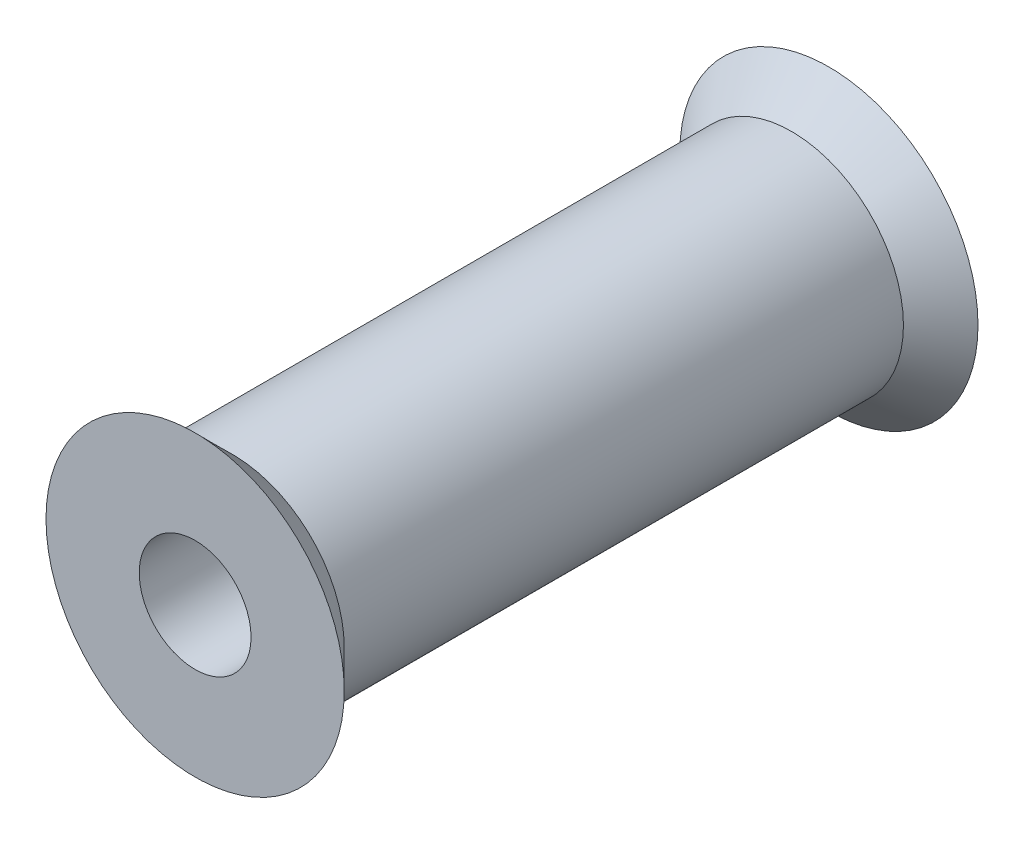
from build123d import *


with BuildPart() as part:
    # 草图2 → 旋转1 (revolve)
    with BuildSketch(Plane(origin=(0, 0, 0), x_dir=(1, 0, 0), z_dir=(0, 1, 0))):
        Polygon((5.5, 17), (5.5, 0), (7, 0), (7, 1), (7, 16), (7, 17), align=None)
        Polygon((7, 1), (7, 0), (8, 0), align=None)
        Polygon((8, 17), (7, 17), (7, 16), align=None)
    revolve(axis=Axis((4, 0, 0), (0, 0, -1)))


solid = part.part
